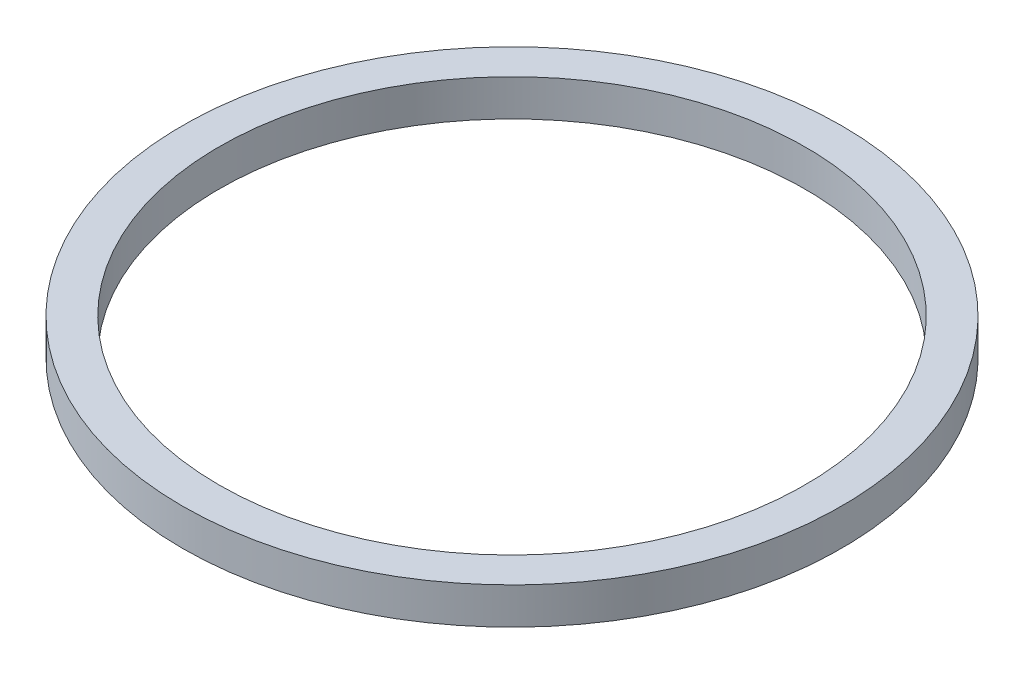
from build123d import *

# Parameters (mm, degrees)
SKETCH_1_R      = 0.9
SKETCH_1_R_2    = 0.8
EXTRUDE_1_DEPTH = 0.1


with BuildPart() as part:
    # 草图1 → 凸台-拉伸1 (new body)
    with BuildSketch(Plane(origin=(0, 0, 0), x_dir=(1, 0, 0), z_dir=(0, 1, 0))):
        with Locations(Location((0, 0, 0), (0, 0, 270))):
            Circle(SKETCH_1_R)
        with Locations(Location((0, 0, 0), (0, 0, 270))):
            Circle(SKETCH_1_R_2, mode=Mode.SUBTRACT)
    extrude(amount=EXTRUDE_1_DEPTH)


solid = part.part
